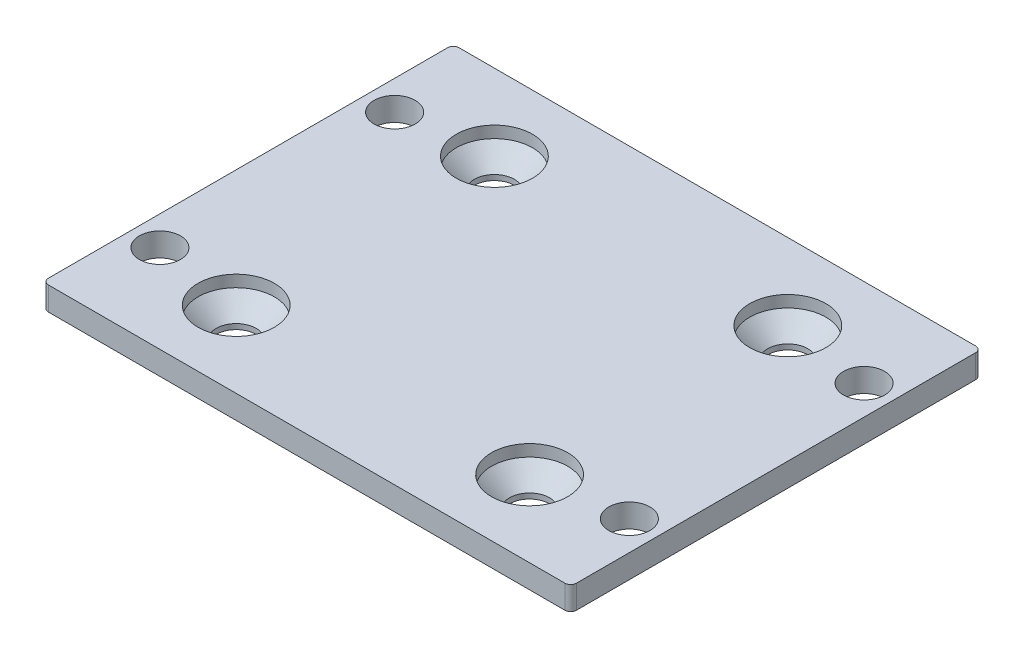
from build123d import *

# Parameters (mm, degrees)
ESQUISSE1_W                              = 45
ESQUISSE1_H                              = 35
BOSS_EXTRU_1_DEPTH                       = 2
ESQUISSE2_W                              = 35
ESQUISSE2_H                              = 32
BOSS_EXTRU_2_DEPTH                       = 1
CONG_1_R                                 = 5
CONG_2_R                                 = 0.5
CHANFREIN1_SIZE                          = 0.5
ESQUISSE3_R                              = 1.75
ENL_V_MAT_EXTRU_1_DEPTH                  = 29.574464124
DIAM_TRE_DU_PER_AGE_6_5_6_5_1_D          = 6.5
DIAM_TRE_DU_PER_AGE_6_5_6_5_1_DEPTH      = 1
FRAISAGE_POUR_VIS_T_TE_FRAIS_E_6_2_COUNT = 2
FRAISAGE_POUR_VIS_T_TE_FRAIS_E_6_2_PITCH = 33.301651611
FRAISAGE_POUR_VIS_T_TE_FRAIS_E_6_3_COUNT = 2
FRAISAGE_POUR_VIS_T_TE_FRAIS_E_6_3_PITCH = 22
FRAISAGE_POUR_VIS_T_TE_FRAIS_E_6_4_COUNT = 2
FRAISAGE_POUR_VIS_T_TE_FRAIS_E_6_4_PITCH = 25


with BuildPart() as part:
    # Esquisse1 → Boss.-Extru.1 (new body)
    with BuildSketch(Plane(origin=(0, 0, 0), x_dir=(1, 0, 0), z_dir=(0, 1, 0))):
        Rectangle(ESQUISSE1_W, ESQUISSE1_H)
    extrude(amount=BOSS_EXTRU_1_DEPTH)

    # Esquisse2 → Boss.-Extru.2 (add)
    with BuildSketch(Plane.XZ):
        Rectangle(ESQUISSE2_W, ESQUISSE2_H)
    extrude(amount=BOSS_EXTRU_2_DEPTH)

    # Congé1
    cong_1_edges = [part.edges().sort_by_distance(p)[0] for p in [
        (17.5, -0.5, -16),
        (17.5, -0.5, 16),
        (-17.5, -0.5, 16),
        (-17.5, -0.5, -16),
    ]]
    fillet(cong_1_edges, radius=CONG_1_R)

    # Congé2
    cong_2_edges = [part.edges().sort_by_distance(p)[0] for p in [
        (22.5, 1, 17.5),
        (-22.5, 1, 17.5),
        (-22.5, 1, -17.5),
        (22.5, 1, -17.5),
    ]]
    fillet(cong_2_edges, radius=CONG_2_R)

    # Chanfrein1
    chanfrein1_edges = [part.edges().sort_by_distance(p)[0] for p in [
        (0, -1, 16),
        (17.5, -1, 0),
        (-17.5, -1, 0),
        (0, -1, -16),
        (-16.035533906, -1, 14.535533906),
        (16.035533906, -1, -14.535533906),
        (-16.035533906, -1, -14.535533906),
        (16.035533906, -1, 14.535533906),
    ]]
    chamfer(chanfrein1_edges, length=CHANFREIN1_SIZE)

    # Esquisse3 → Enlèv. mat.-Extru.1 (cut, through all)
    with BuildSketch(Plane.XZ):
        with Locations(Location((-20, 10, 0), (0, 0, 270))):
            Circle(ESQUISSE3_R)
        with Locations(Location((20, 10, 0), (0, 0, 270))):
            Circle(ESQUISSE3_R)
        with Locations(Location((20, -10, 0), (0, 0, 270))):
            Circle(ESQUISSE3_R)
        with Locations(Location((-20, -10, 0), (0, 0, 270))):
            Circle(ESQUISSE3_R)
    extrude(amount=-ENL_V_MAT_EXTRU_1_DEPTH, mode=Mode.SUBTRACT)

    # Diamètre du perçage Ø6.5 (6.5)1
    with Locations(Plane(origin=(0, 2, 0), x_dir=(1, 0, 0), z_dir=(0, 1, 0))):
        with Locations((-12.5, -11), (12.5, 11), (-12.5, 11), (12.5, -11)):
            Hole(DIAM_TRE_DU_PER_AGE_6_5_6_5_1_D / 2, depth=DIAM_TRE_DU_PER_AGE_6_5_6_5_1_DEPTH)

    # Esquisse4 → Fraisage pour vis à tête fraisée à 6 pans creux M31 (revolve, cut)
    with BuildSketch(Plane(origin=(-12.5, 1, -11), x_dir=(0, 0, 1), z_dir=(1, 0, 0))):
        Polygon((0, 0), (0, 2), (1.7, 2), (1.7, 1.55), (3.25, 0), align=None)
    fraisage_pour_vis_t_te_frais_e_6_pan = revolve(axis=Axis((-12.5, 7.35, -11), (0, -1, 0)), mode=Mode.SUBTRACT)

    # Fraisage pour vis _ t_te frais_e _ 6 2: Fraisage pour vis à tête fraisée à 6 pans creux M31 ×2
    with Locations(*[Vector(0.7507135169227553, 0, 0.6606278948920248) * (i * FRAISAGE_POUR_VIS_T_TE_FRAIS_E_6_2_PITCH) for i in range(1, FRAISAGE_POUR_VIS_T_TE_FRAIS_E_6_2_COUNT)]):
        add(fraisage_pour_vis_t_te_frais_e_6_pan, mode=Mode.SUBTRACT)

    # Fraisage pour vis _ t_te frais_e _ 6 3: Fraisage pour vis à tête fraisée à 6 pans creux M31 ×2
    with Locations(*[(0, 0, i * FRAISAGE_POUR_VIS_T_TE_FRAIS_E_6_3_PITCH) for i in range(1, FRAISAGE_POUR_VIS_T_TE_FRAIS_E_6_3_COUNT)]):
        add(fraisage_pour_vis_t_te_frais_e_6_pan, mode=Mode.SUBTRACT)

    # Fraisage pour vis _ t_te frais_e _ 6 4: Fraisage pour vis à tête fraisée à 6 pans creux M31 ×2
    with Locations(*[(i * FRAISAGE_POUR_VIS_T_TE_FRAIS_E_6_4_PITCH, 0, 0) for i in range(1, FRAISAGE_POUR_VIS_T_TE_FRAIS_E_6_4_COUNT)]):
        add(fraisage_pour_vis_t_te_frais_e_6_pan, mode=Mode.SUBTRACT)


solid = part.part
